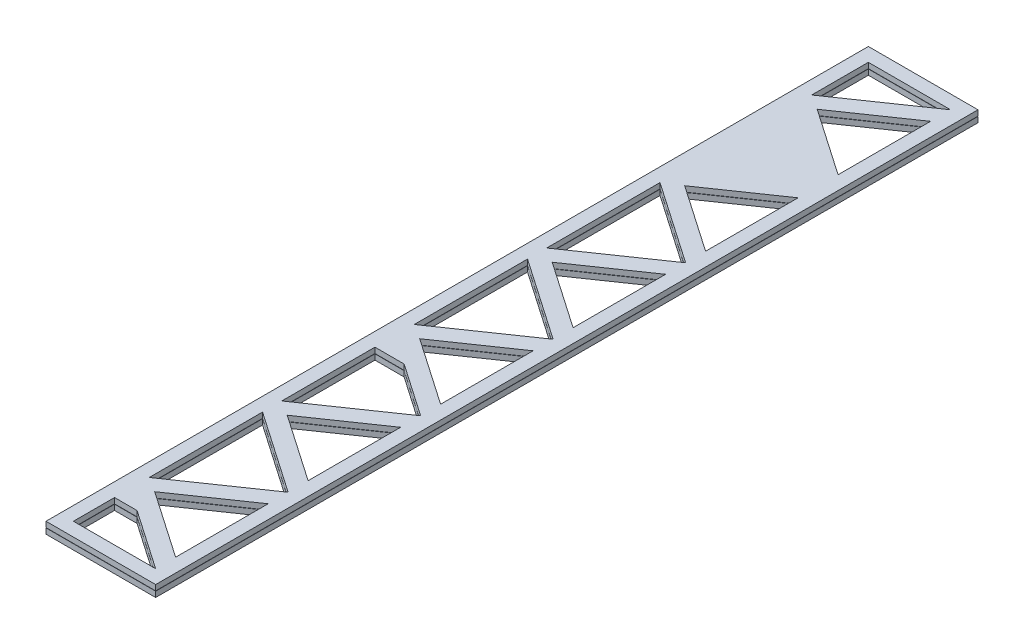
from build123d import *

# Parameters (mm, degrees)
SKETCH_2_W          = 40
SKETCH_2_H          = 2
EXTRUDE_1_DEPTH     = 300
EXTRUDE_1_2_DEPTH   = 300
CUT_EXTRUDE_1_DEPTH = 1076.662797098


with BuildPart() as part:
    # 草图2 → 凸台-拉伸1 (new body)
    with BuildSketch(Plane.XY.offset(762.01)):
        with Locations((150.787596038, -2.339694097)):
            Rectangle(SKETCH_2_W, SKETCH_2_H)
    extrude(amount=EXTRUDE_1_DEPTH)


with BuildPart() as body_2:
    # 草图2 → Extrude 1 2 (new body)
    with BuildSketch(Plane.XY.offset(762.01)):
        with Locations((150.787596038, -4.439694097)):
            Rectangle(SKETCH_2_W, SKETCH_2_H)
    extrude(amount=EXTRUDE_1_2_DEPTH)


with BuildPart() as cut_extrude_1_tool:
    # 草图3 → 切除-拉伸1 (new, through all)
    with BuildSketch(Plane(origin=(0, -1.339694097, 0), x_dir=(1, 0, 0), z_dir=(0, 1, 0))):
        Polygon((135.787596038, -1057.01), (165.787596038, -1057.01), (144.013402489, -1042.01), (135.787596038, -1042.01), align=None)
        Polygon((141.283267851, -1032.843333333), (165.787596038, -1049.724092751), (165.787596038, -1015.962573916), align=None)
        Polygon((135.787596038, -1029.343333333), (165.787596038, -1008.676666667), (135.787596038, -988.01), align=None)
        Polygon((141.283267851, -984.51), (165.787596038, -1001.390759417), (165.787596038, -967.629240583), align=None)
        Polygon((135.787596038, -947.01), (135.787596038, -981.01), (165.787596038, -960.343333333), (146.432757328, -947.01), align=None)
        Polygon((141.283267851, -936.176666667), (165.787596038, -953.057426084), (165.787596038, -919.295907249), align=None)
        Polygon((135.787596038, -891.343333333), (135.787596038, -932.676666667), (165.787596038, -912.01), align=None)
        Polygon((141.283267851, -887.843333333), (165.787596038, -904.724092751), (165.787596038, -870.962573916), align=None)
        Polygon((135.787596038, -843.01), (135.787596038, -884.343333333), (165.787596038, -863.676666667), align=None)
        Polygon((141.283267851, -839.51), (165.787596038, -856.390759417), (165.787596038, -822.629240583), align=None)
        Polygon((135.787596038, -767.01), (135.787596038, -787.676666667), (165.787596038, -767.01), align=None)
        Polygon((141.283267851, -791.176666667), (165.787596038, -808.057426084), (165.787596038, -774.295907249), align=None)
    extrude(amount=-CUT_EXTRUDE_1_DEPTH)


with BuildPart() as part_1:
    add(part.part)

    # 切除-拉伸1: cut by cut_extrude_1_tool
    add(cut_extrude_1_tool.part, mode=Mode.SUBTRACT)


with BuildPart() as body_2_1:
    add(body_2.part)

    # 切除-拉伸1: cut by cut_extrude_1_tool
    add(cut_extrude_1_tool.part, mode=Mode.SUBTRACT)


solid = Compound([part_1.part, body_2_1.part])
